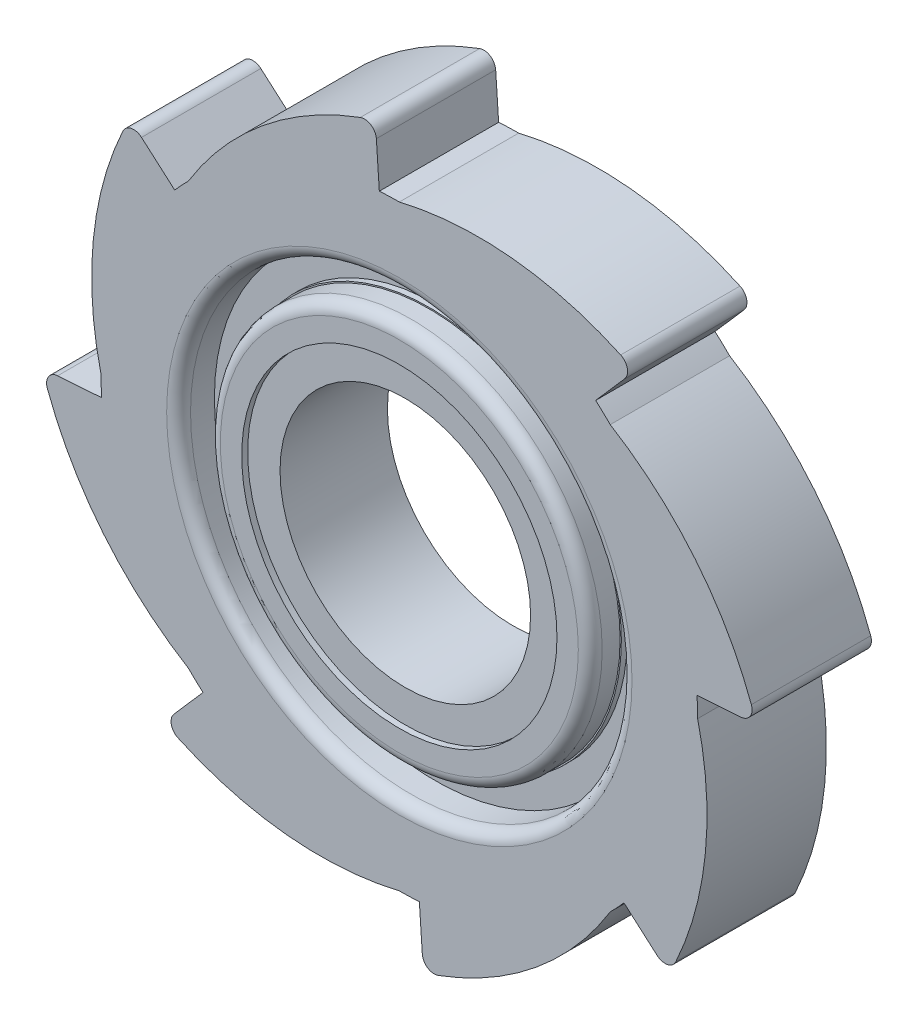
from build123d import *

# Parameters (mm, degrees)
SKETCH1_R           = 21
BOSS_EXTRUDE1_DEPTH = 10
SKETCH11_R          = 26.424144251
CUT_EXTRUDE2_DEPTH  = 1
FILLET1_R           = 2
SKETCH12_R          = 37
SKETCH12_R_2        = 32.216977435
CUT_EXTRUDE3_DEPTH  = 5
SKETCH13_R          = 37
SKETCH13_R_2        = 32
CUT_EXTRUDE5_DEPTH  = 5
FILLET2_R           = 2


with BuildPart() as part:
    # Sketch1 → Boss-Extrude1 (new body)
    with BuildSketch(Plane.XY):
        with BuildLine():
            Line((49.887269323, 3.355645919), (59.864723187, 4.026775102))
            ThreePointArc((59.864723187, 4.026775102), (50.436634414, 21.90240344), (35.355339059, 35.355339059))
            ThreePointArc((35.355339059, 35.355339059), (34.148336007, 36.52247456), (32.902826449, 37.648426417))
            Line((32.902826449, 37.648426417), (39.483391738, 45.178111701))
            ThreePointArc((39.483391738, 45.178111701), (20.176748218, 51.151424211), (0, 50))
            ThreePointArc((0, 50), (-1.67876947, 49.971809384), (-3.355645919, 49.887269323))
            Line((-3.355645919, 49.887269323), (-4.026775102, 59.864723187))
            ThreePointArc((-4.026775102, 59.864723187), (-21.90240344, 50.436634414), (-35.355339059, 35.355339059))
            ThreePointArc((-35.355339059, 35.355339059), (-36.52247456, 34.148336007), (-37.648426417, 32.902826449))
            Line((-37.648426417, 32.902826449), (-45.178111701, 39.483391738))
            ThreePointArc((-45.178111701, 39.483391738), (-51.151424211, 20.176748218), (-50, 0))
            ThreePointArc((-50, 0), (-49.971809384, -1.67876947), (-49.887269323, -3.355645919))
            Line((-49.887269323, -3.355645919), (-59.864723187, -4.026775102))
            ThreePointArc((-59.864723187, -4.026775102), (-50.436634414, -21.90240344), (-35.355339059, -35.355339059))
            ThreePointArc((-35.355339059, -35.355339059), (-34.148336007, -36.52247456), (-32.902826449, -37.648426417))
            Line((-32.902826449, -37.648426417), (-39.483391738, -45.178111701))
            ThreePointArc((-39.483391738, -45.178111701), (-20.176748218, -51.151424211), (0, -50))
            ThreePointArc((0, -50), (1.67876947, -49.971809384), (3.355645919, -49.887269323))
            Line((3.355645919, -49.887269323), (4.026775102, -59.864723187))
            ThreePointArc((4.026775102, -59.864723187), (21.90240344, -50.436634414), (35.355339059, -35.355339059))
            ThreePointArc((35.355339059, -35.355339059), (36.52247456, -34.148336007), (37.648426417, -32.902826449))
            Line((37.648426417, -32.902826449), (45.178111701, -39.483391738))
            ThreePointArc((45.178111701, -39.483391738), (51.151424211, -20.176748218), (50, 0))
            ThreePointArc((50, 0), (49.971809384, 1.67876947), (49.887269323, 3.355645919))
        make_face()
        Circle(SKETCH1_R, mode=Mode.SUBTRACT)
    boss_extrude1 = extrude(amount=BOSS_EXTRUDE1_DEPTH)

    # Sketch11 → Cut-Extrude2 (cut)
    with BuildSketch(Plane.XY.offset(10)):
        Circle(SKETCH11_R)
    cut_extrude2 = extrude(amount=-CUT_EXTRUDE2_DEPTH, mode=Mode.SUBTRACT)

    # Mirror1: Boss-Extrude1, Cut-Extrude2 across Front Plane
    add(boss_extrude1.mirror(Plane.XY))
    add(cut_extrude2.mirror(Plane.XY), mode=Mode.SUBTRACT)

    # Fillet1
    fillet1_edges = [part.edges().sort_by_distance(p)[0] for p in [
        (59.864723187, 4.026775102, 0),
        (45.178111701, -39.483391738, 0),
        (4.026775102, -59.864723187, 0),
        (-39.483391738, -45.178111701, 0),
        (-59.864723187, -4.026775102, 0),
        (-45.178111701, 39.483391738, 0),
        (-4.026775102, 59.864723187, 0),
        (39.483391738, 45.178111701, 0),
    ]]
    fillet(fillet1_edges, radius=FILLET1_R)

    # Sketch12 → Cut-Extrude3 (cut)
    with BuildSketch(Plane.XY.offset(9)):
        Circle(SKETCH12_R)
        Circle(SKETCH12_R_2, mode=Mode.SUBTRACT)
    extrude(amount=-CUT_EXTRUDE3_DEPTH, mode=Mode.SUBTRACT)

    # Sketch13 → Cut-Extrude5 (cut)
    with BuildSketch(Plane.XY.offset(10)):
        Circle(SKETCH13_R)
        Circle(SKETCH13_R_2, mode=Mode.SUBTRACT)
    extrude(amount=-CUT_EXTRUDE5_DEPTH, mode=Mode.SUBTRACT)

    # Fillet2
    fillet2_edges = [part.edges().sort_by_distance(p)[0] for p in [
        (-37, 0, 10),
        (-32, 0, 10),
    ]]
    fillet(fillet2_edges, radius=FILLET2_R)


solid = part.part
